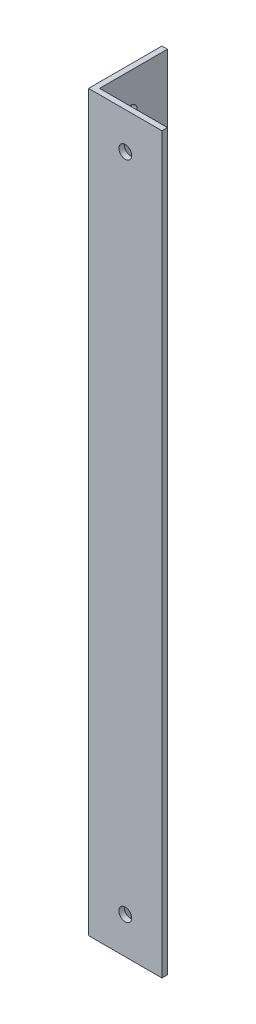
from build123d import *

# Parameters (mm, degrees)
EXTRUDE_1_DEPTH          = 200
CUT_EXTRUDE_1_REACH      = 203.99
SKETCH_2_R               = 1.75
MIRROR_2_COPY_1_REACH    = 203.99
MIRROR_2_COPY_1_SKETCH_R = 1.75


with BuildPart() as part:
    # Эскиз1 → Бобышка-Вытянуть1 (new body)
    with BuildSketch(Plane(origin=(0, 0, 0), x_dir=(1, 0, 0), z_dir=(0, 1, 0))):
        Polygon((0, 0), (20, 0), (20, 1.5), (1.5, 1.5), (1.5, 20), (0, 20), align=None)
    extrude(amount=EXTRUDE_1_DEPTH)

    # Эскиз2 → Вырез-Вытянуть1 (cut, up to next)
    with BuildSketch(Plane.XY, mode=Mode.PRIVATE) as cut_extrude_1_sk1:
        with Locations((10, 190)):
            Circle(SKETCH_2_R)
    cut_extrude_1_tool1 = extrude(cut_extrude_1_sk1.sketch, amount=-CUT_EXTRUDE_1_REACH, mode=Mode.PRIVATE) & part.part
    cut_extrude_1 = cut_extrude_1_tool1.solids().sort_by_distance((10, 190, 0))[0]
    add(cut_extrude_1, mode=Mode.SUBTRACT)

    # Зеркальное отражение1: Вырез-Вытянуть1 across plane
    add(cut_extrude_1.mirror(Plane(origin=(0, 0, 0), x_dir=(-0.7071067811865482, 0, 0.7071067811865468), z_dir=(-0.7071067811865468, 0, -0.7071067811865482))), mode=Mode.SUBTRACT)

    # Зеркальное отражение2: Вырез-Вытянуть1 across plane
    add(cut_extrude_1.mirror(Plane(origin=(0, 100, 0), x_dir=(0, 0, 1), z_dir=(0, -1, 0))), mode=Mode.SUBTRACT)

    # Зеркальное отражение2 copy 1 sketch → Зеркальное отражение2 copy 1 (cut, up to next)
    with BuildSketch(Plane(origin=(0, 200, 0), x_dir=(0, 0, -1), z_dir=(-1, 0, 0)), mode=Mode.PRIVATE) as mirror_2_copy_1_sk1:
        with Locations((10, 190)):
            Circle(MIRROR_2_COPY_1_SKETCH_R)
    mirror_2_copy_1_tool1 = extrude(mirror_2_copy_1_sk1.sketch, amount=-MIRROR_2_COPY_1_REACH, mode=Mode.PRIVATE) & part.part
    add(mirror_2_copy_1_tool1.solids().sort_by_distance((0, 10, -10))[0], mode=Mode.SUBTRACT)


solid = part.part
